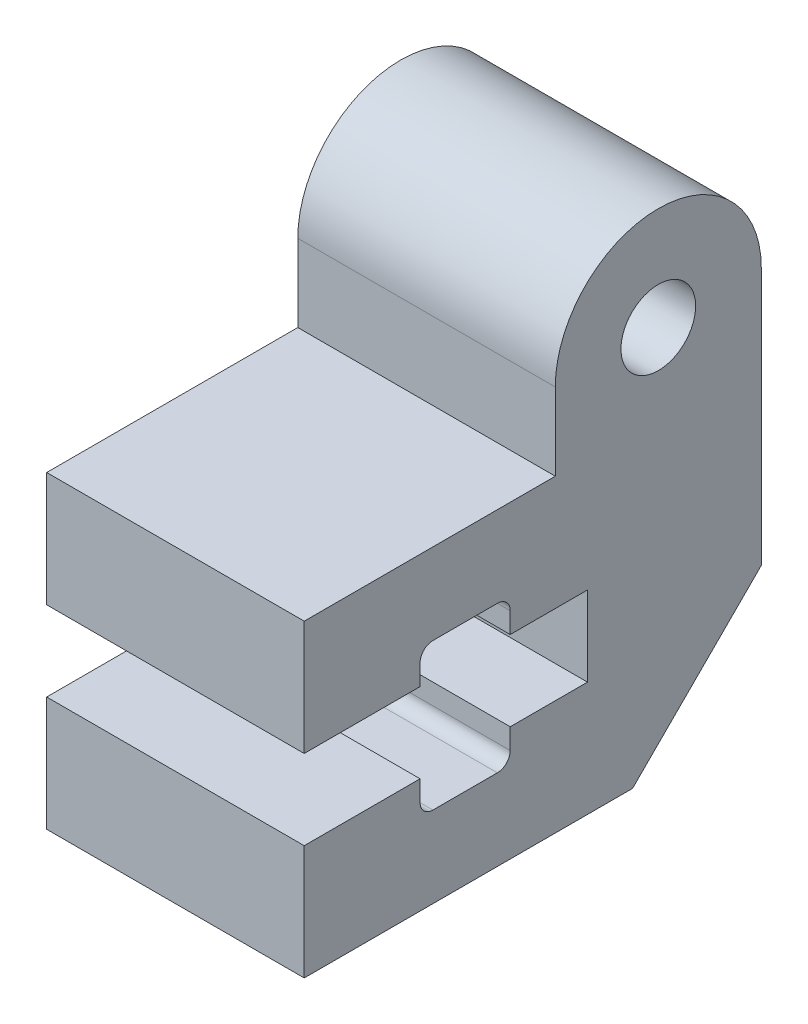
from build123d import *

# Parameters (mm, degrees)
SKETCH1_R           = 1.45
BOSS_EXTRUDE1_DEPTH = 10
CUT_EXTRUDE1_DEPTH  = 73.480414599
SKETCH3_OUTSIDE_W   = 79.465
SKETCH3_OUTSIDE_H   = 60.027
CUT_EXTRUDE2_DEPTH  = 10


with BuildPart() as part:
    # Sketch1 → Boss-Extrude1 (new body)
    with BuildSketch(Plane(origin=(0, 0, 0), x_dir=(0, 0, -1), z_dir=(1, 0, 0))):
        with BuildLine():
            Line((0, 0), (9.75, 0))
            Line((9.75, 0), (9.75, 3))
            ThreePointArc((9.75, 3), (13.75, 7), (17.75, 3))
            Line((17.75, 3), (17.75, -2.652410493))
            Line((17.75, -2.652410493), (60.297873163, -28.367393861))
            ThreePointArc((60.297873163, -28.367393861), (61.652223967, -33.859727964), (56.159889865, -35.214078769))
            Line((56.159889865, -35.214078769), (17.75, -12))
            Line((17.75, -12), (0, -12))
            Line((0, -12), (0, 0))
        make_face()
        with Locations((13.75, 3)):
            Circle(SKETCH1_R, mode=Mode.SUBTRACT)
        with Locations((58.228881514, -31.790736315)):
            Circle(SKETCH1_R, mode=Mode.SUBTRACT)
    extrude(amount=BOSS_EXTRUDE1_DEPTH)

    # Sketch2 → Cut-Extrude1 (cut, through all)
    with BuildSketch(Plane(origin=(10, 0, 0), x_dir=(0, 0, -1), z_dir=(1, 0, 0))):
        with BuildLine():
            Line((0, -7.55), (0, -4.45))
            Line((0, -4.45), (4.5, -4.45))
            Line((4.5, -4.45), (4.5, -3.65))
            ThreePointArc((4.5, -3.65), (4.646446609, -3.296446609), (5, -3.15))
            Line((5, -3.15), (7.5, -3.15))
            ThreePointArc((7.5, -3.15), (7.853553391, -3.296446609), (8, -3.65))
            Line((8, -3.65), (8, -4.45))
            Line((8, -4.45), (11, -4.45))
            Line((11, -4.45), (11, -7.55))
            Line((11, -7.55), (8, -7.55))
            Line((8, -7.55), (8, -8.35))
            ThreePointArc((8, -8.35), (7.853553391, -8.703553391), (7.5, -8.85))
            Line((7.5, -8.85), (5, -8.85))
            ThreePointArc((5, -8.85), (4.646446609, -8.703553391), (4.5, -8.35))
            Line((4.5, -8.35), (4.5, -7.55))
            Line((4.5, -7.55), (0, -7.55))
        make_face()
    extrude(amount=-CUT_EXTRUDE1_DEPTH, mode=Mode.SUBTRACT)

    # Sketch3 outside → Cut-Extrude2 (cut)
    with BuildSketch(Plane(origin=(10, 0, 0), x_dir=(0, 0, -1), z_dir=(1, 0, 0))):
        with Locations((31.1145, -14.3955)):
            Rectangle(SKETCH3_OUTSIDE_W, SKETCH3_OUTSIDE_H)
        Polygon((17.75, -7), (12.75, -12), (0, -12), (0, 0), (17.75, 43), align=None, mode=Mode.SUBTRACT)
    extrude(amount=-CUT_EXTRUDE2_DEPTH, mode=Mode.SUBTRACT)


solid = part.part
